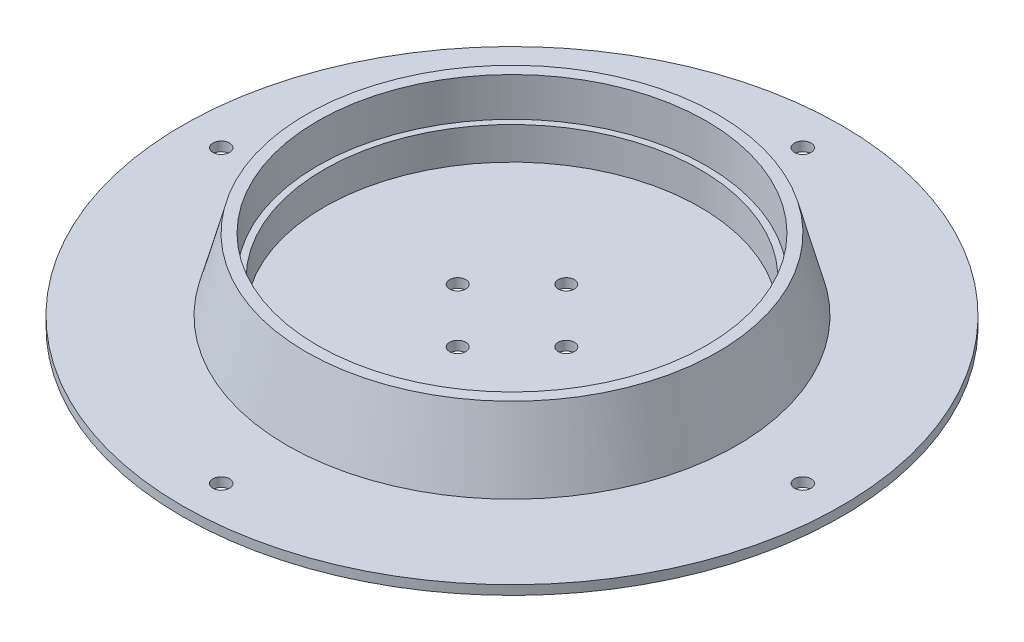
from build123d import *

# Parameters (mm, degrees)
SKETCH1_R           = 85
SKETCH1_R_2         = 2.132457031
SKETCH1_R_3         = 2.1
BOSS_EXTRUDE1_DEPTH = 2.4
SKETCH2_R           = 58
BOSS_EXTRUDE2_DEPTH = 18.4
BOSS_EXTRUDE2_TAPER = 15
SKETCH3_R           = 50.15
CUT_EXTRUDE1_DEPTH  = 10
SKETCH4_R           = 48.5
CUT_EXTRUDE2_DEPTH  = 8.4


with BuildPart() as part:
    # Sketch1 → Boss-Extrude1 (new body)
    with BuildSketch(Plane(origin=(0, 0, 0), x_dir=(1, 0, 0), z_dir=(0, 1, 0))):
        with Locations(Location((0, 0, 0), (0, 0, 270))):
            Circle(SKETCH1_R)
        with Locations(Location((-75, 0, 0), (0, 0, 270))):
            Circle(SKETCH1_R_2, mode=Mode.SUBTRACT)
        with Locations(Location((0, 75, 0), (0, 0, 270))):
            Circle(SKETCH1_R_2, mode=Mode.SUBTRACT)
        with Locations(Location((75, 0, 0), (0, 0, 270))):
            Circle(SKETCH1_R_2, mode=Mode.SUBTRACT)
        with Locations(Location((0, -75, 0), (0, 0, 270))):
            Circle(SKETCH1_R_2, mode=Mode.SUBTRACT)
        with Locations(Location((-14, 0, 0), (0, 0, 270))):
            Circle(SKETCH1_R_3, mode=Mode.SUBTRACT)
        with Locations(Location((0, 14, 0), (0, 0, 270))):
            Circle(SKETCH1_R_3, mode=Mode.SUBTRACT)
        with Locations(Location((14, 0, 0), (0, 0, 270))):
            Circle(SKETCH1_R_3, mode=Mode.SUBTRACT)
        with Locations(Location((0, -14, 0), (0, 0, 270))):
            Circle(SKETCH1_R_3, mode=Mode.SUBTRACT)
    extrude(amount=BOSS_EXTRUDE1_DEPTH)

    # Sketch2 → Boss-Extrude2 (add)
    with BuildSketch(Plane(origin=(0, 2.4, 0), x_dir=(1, 0, 0), z_dir=(0, 1, 0))):
        Circle(SKETCH2_R)
    extrude(amount=BOSS_EXTRUDE2_DEPTH, taper=BOSS_EXTRUDE2_TAPER)

    # Sketch3 → Cut-Extrude1 (cut)
    with BuildSketch(Plane(origin=(0, 20.8, 0), x_dir=(1, 0, 0), z_dir=(0, 1, 0))):
        with Locations(Location((0, 0, 0), (0, 0, 270))):
            Circle(SKETCH3_R)
    extrude(amount=-CUT_EXTRUDE1_DEPTH, mode=Mode.SUBTRACT)

    # Sketch4 → Cut-Extrude2 (cut)
    with BuildSketch(Plane(origin=(0, 10.8, 0), x_dir=(1, 0, 0), z_dir=(0, 1, 0))):
        with Locations(Location((0, 0, 0), (0, 0, 270))):
            Circle(SKETCH4_R)
    extrude(amount=-CUT_EXTRUDE2_DEPTH, mode=Mode.SUBTRACT)


solid = part.part
